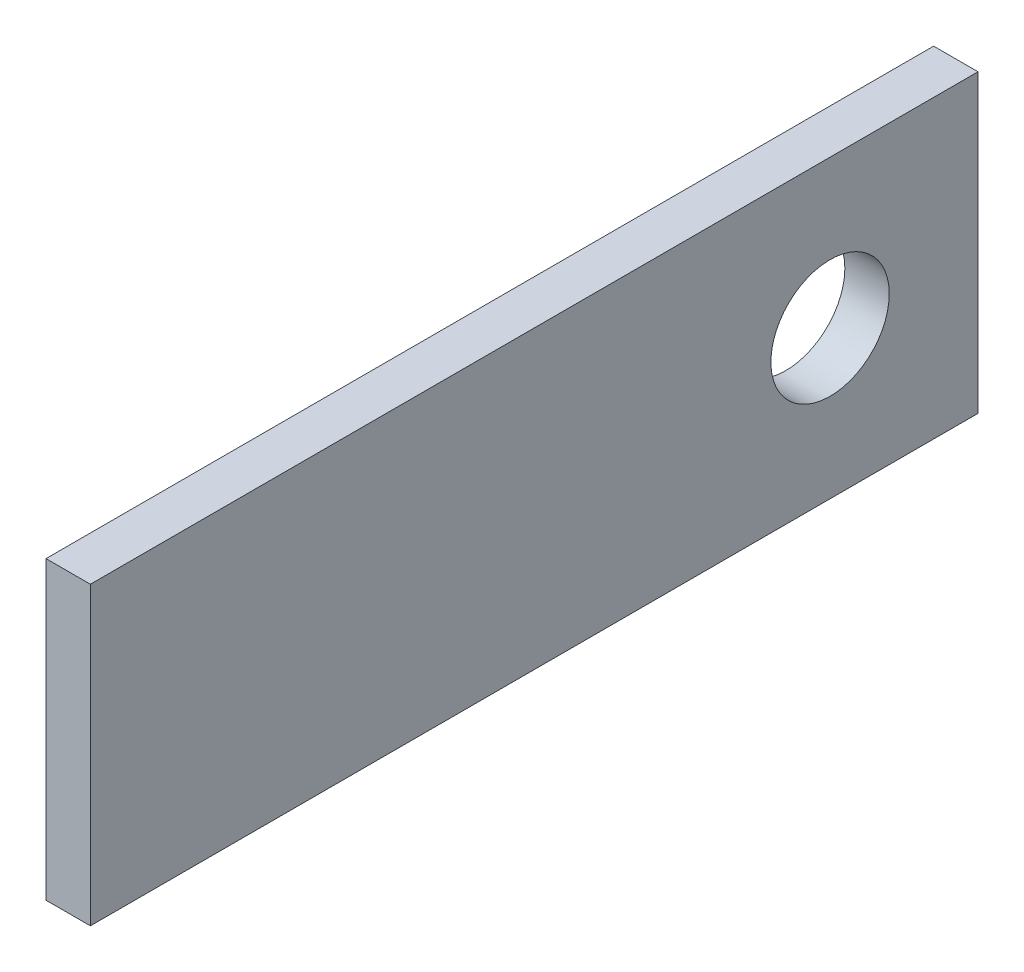
from build123d import *

# Parameters (mm, degrees)
SKETCH1_W           = 120
SKETCH1_H           = 40
SKETCH1_R           = 8
BOSS_EXTRUDE1_DEPTH = 6


with BuildPart() as part:
    # Sketch1 → Boss-Extrude1 (new body)
    with BuildSketch(Plane(origin=(0, 0, 0), x_dir=(0, 0, -1), z_dir=(1, 0, 0))):
        Rectangle(SKETCH1_W, SKETCH1_H)
        with Locations((40, 0)):
            Circle(SKETCH1_R, mode=Mode.SUBTRACT)
    extrude(amount=BOSS_EXTRUDE1_DEPTH)


solid = part.part
